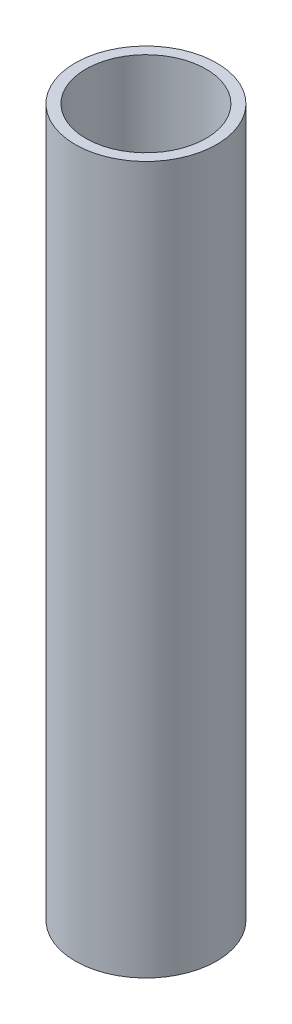
from build123d import *

# Parameters (mm, degrees)
CIRKEL1_R          = 10
CILINDER_DEPTH     = 100
CIRKEL2_R          = 8.5
CILINDER_HOL_DEPTH = 200


with BuildPart() as part:
    # cirkel1 → cilinder (new body)
    with BuildSketch(Plane(origin=(0, 0, 0), x_dir=(1, 0, 0), z_dir=(0, 1, 0))):
        with Locations(Location((0, 0, 0), (0, 0, 270))):
            Circle(CIRKEL1_R)
    extrude(amount=CILINDER_DEPTH)

    # cirkel2 → cilinder_hol (cut)
    with BuildSketch(Plane(origin=(0, 100, 0), x_dir=(1, 0, 0), z_dir=(0, 1, 0))):
        with Locations(Location((0, 0, 0), (0, 0, 270))):
            Circle(CIRKEL2_R)
    extrude(amount=-CILINDER_HOL_DEPTH, mode=Mode.SUBTRACT)


solid = part.part
